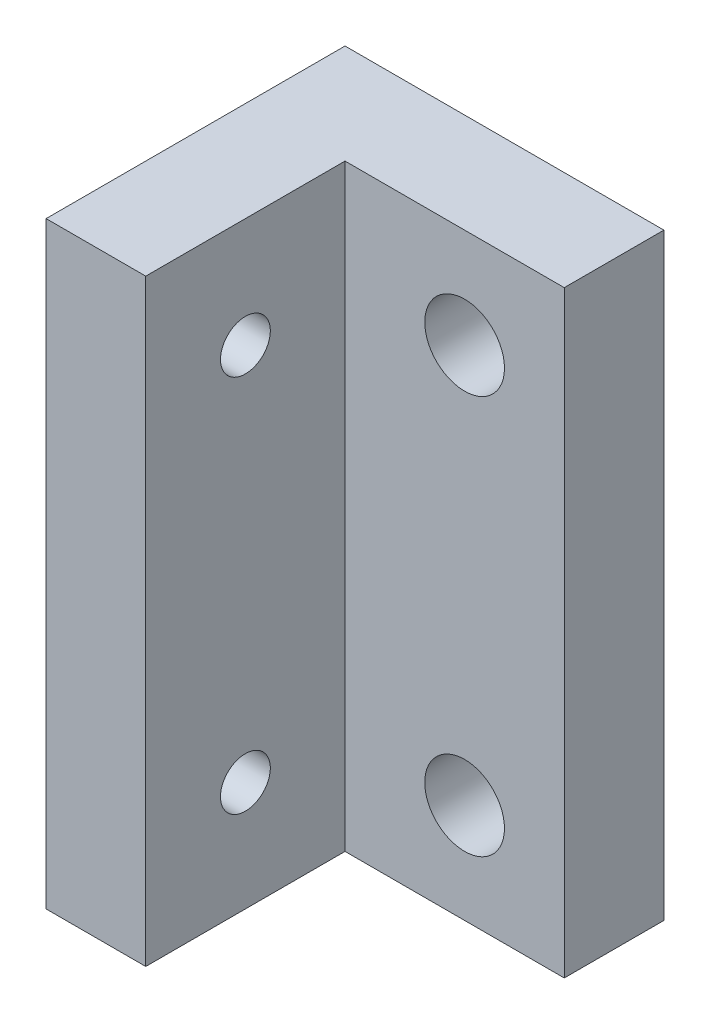
from build123d import *

# Parameters (mm, degrees)
BOSS_EXTRUDE1_DEPTH = 15
SKETCH2_R           = 2
CUT_EXTRUDE1_DEPTH  = 25.103941586
SKETCH3_R           = 1.25
CUT_EXTRUDE2_DEPTH  = 27.570660511


with BuildPart() as part:
    # Sketch1 → Boss-Extrude1 (new, symmetric)
    with BuildSketch(Plane(origin=(0, 0, 0), x_dir=(1, 0, 0), z_dir=(0, 1, 0))):
        Polygon((0, 0), (16, 0), (16, -5), (5, -5), (5, -15), (0, -15), align=None)
    extrude(amount=BOSS_EXTRUDE1_DEPTH, both=True)

    # Sketch2 → Cut-Extrude1 (cut, through all)
    with BuildSketch(Plane.XY.offset(5)):
        with Locations((11, 10)):
            Circle(SKETCH2_R)
        with Locations((11, -10)):
            Circle(SKETCH2_R)
    extrude(amount=-CUT_EXTRUDE1_DEPTH, mode=Mode.SUBTRACT)

    # Sketch3 → Cut-Extrude2 (cut, through all)
    with BuildSketch(Plane.ZY):
        with Locations((10, 9.5)):
            Circle(SKETCH3_R)
        with Locations((10, -9.5)):
            Circle(SKETCH3_R)
    extrude(amount=-CUT_EXTRUDE2_DEPTH, mode=Mode.SUBTRACT)


solid = part.part
